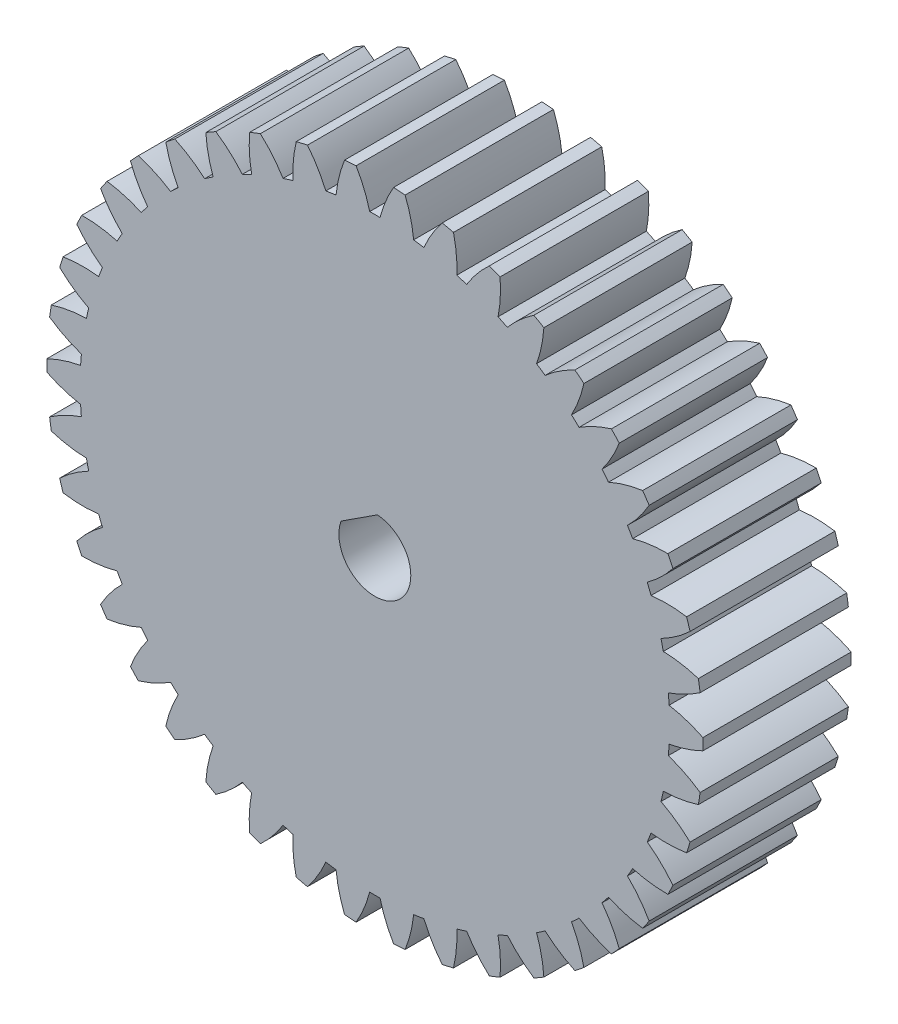
from build123d import *

# Parameters (mm, degrees)
BOSS_EXTRUDE1_DEPTH = 10


with BuildPart() as part:
    # Model → Boss-Extrude1 (new body)
    with BuildSketch(Plane.XY):
        with BuildLine():
            ThreePointArc((-22.121579276, -0.389044164), (-21.007963184, -0.843644989), (-19.841449955, -1.136987106))
            ThreePointArc((-19.841449955, -1.136987106), (-19.818428265, -1.48518588), (-19.789296488, -1.832926766))
            ThreePointArc((-19.789296488, -1.832926766), (-20.899060353, -2.296852269), (-21.932483536, -2.912351445))
            ThreePointArc((-21.932483536, -2.912351445), (-21.877882031, -3.297560139), (-21.816515489, -3.681749169))
            ThreePointArc((-21.816515489, -3.681749169), (-20.647582831, -3.965296612), (-19.450378218, -4.081502565))
            ThreePointArc((-19.450378218, -4.081502565), (-19.375717327, -4.422381042), (-19.295082838, -4.761896083))
            ThreePointArc((-19.295082838, -4.761896083), (-20.323307049, -5.386041643), (-21.253452357, -6.148689934))
            ThreePointArc((-21.253452357, -6.148689934), (-21.142048328, -6.521458234), (-21.024106796, -6.892209981))
            ThreePointArc((-21.024106796, -6.892209981), (-19.825969598, -6.998370062), (-18.624817172, -6.934844001))
            ThreePointArc((-18.624817172, -6.934844001), (-18.500184881, -7.260787518), (-18.369848921, -7.58449251))
            ThreePointArc((-18.369848921, -7.58449251), (-19.293564649, -8.354915747), (-20.099654173, -9.247676851))
            ThreePointArc((-20.099654173, -9.247676851), (-19.933936203, -9.599677728), (-19.7620543, -9.948710212))
            ThreePointArc((-19.7620543, -9.948710212), (-18.561476964, -9.875111488), (-17.383208487, -9.633272482))
            ThreePointArc((-17.383208487, -9.633272482), (-17.211388875, -9.937), (-17.034262934, -10.237663908))
            ThreePointArc((-17.034262934, -10.237663908), (-17.832835896, -11.137154839), (-18.496862928, -12.140085949))
            ThreePointArc((-18.496862928, -12.140085949), (-18.280532882, -12.463456285), (-18.058550166, -12.782972695))
            ThreePointArc((-18.058550166, -12.782972695), (-16.882351608, -12.531259242), (-15.753287649, -12.116509574))
            ThreePointArc((-15.753287649, -12.116509574), (-15.538118883, -12.391236322), (-15.318159662, -12.662142811))
            ThreePointArc((-15.318159662, -12.662142811), (-15.973751057, -13.670608295), (-16.48088233, -14.761305587))
            ThreePointArc((-16.48088233, -14.761305587), (-16.218772664, -15.048821823), (-15.951647862, -15.331684692))
            ThreePointArc((-15.951647862, -15.331684692), (-14.826102413, -14.907479372), (-13.771464397, -14.329083864))
            ThreePointArc((-13.771464397, -14.329083864), (-13.517752991, -14.568672901), (-13.259874016, -14.803770367))
            ThreePointArc((-13.259874016, -14.803770367), (-13.757839015, -15.898682952), (-14.096746055, -17.052782051))
            ThreePointArc((-14.096746055, -17.052782051), (-13.794711866, -17.29802155), (-13.488412104, -17.537912188))
            ThreePointArc((-13.488412104, -17.537912188), (-12.438662591, -16.950691047), (-11.482009387, -16.221570098))
            ThreePointArc((-11.482009387, -16.221570098), (-11.195422834, -16.420669401), (-10.905384695, -16.614706156))
            ThreePointArc((-10.905384695, -16.614706156), (-11.234599584, -17.771607304), (-11.397711767, -18.963327542))
            ThreePointArc((-11.397711767, -18.963327542), (-11.0625, -19.160812059), (-10.723867509, -19.352371706))
            ThreePointArc((-10.723867509, -19.352371706), (-9.7733636, -18.615252293), (-8.93606526, -17.751693262))
            ThreePointArc((-8.93606526, -17.751693262), (-8.623005431, -17.905855281), (-8.307287101, -18.054496864))
            ThreePointArc((-8.307287101, -18.054496864), (-8.460397763, -19.247543316), (-8.444071433, -20.450263633))
            ThreePointArc((-8.444071433, -20.450263633), (-8.083170164, -20.595581689), (-7.719769434, -20.73453122))
            ThreePointArc((-7.719769434, -20.73453122), (-6.889743816, -19.863979565), (-6.190504202, -18.885272933))
            ThreePointArc((-6.190504202, -18.885272933), (-5.857964337, -18.991053942), (-5.523618441, -19.090979947))
            ThreePointArc((-5.523618441, -19.090979947), (-5.497204636, -20.293521015), (-5.301804496, -21.480374627))
            ThreePointArc((-5.301804496, -21.480374627), (-4.923275664, -21.570280057), (-4.543224467, -21.653515568))
            ThreePointArc((-4.543224467, -21.653515568), (-3.852218541, -20.668978357), (-3.30665751, -19.596986812))
            ThreePointArc((-3.30665751, -19.596986812), (-2.962065998, -19.652023841), (-2.616561272, -19.701002084))
            ThreePointArc((-2.616561272, -19.701002084), (-2.411213042, -20.886174989), (-2.041104008, -22.030649546))
            ThreePointArc((-2.041104008, -22.030649546), (-1.653403321, -22.063134013), (-1.265191372, -22.08879616))
            ThreePointArc((-1.265191372, -22.08879616), (-0.728641069, -21.012266327), (-0.348945553, -19.87093639))
            ThreePointArc((-0.348945553, -19.87093639), (0, -19.874), (0.348945552, -19.87093639))
            ThreePointArc((0.348945552, -19.87093639), (0.728641068, -21.012266327), (1.265191371, -22.08879616))
            ThreePointArc((1.265191371, -22.08879616), (1.65340332, -22.063134013), (2.041104007, -22.030649547))
            ThreePointArc((2.041104007, -22.030649547), (2.411213041, -20.886174989), (2.616561271, -19.701002084))
            ThreePointArc((2.616561271, -19.701002084), (2.962065998, -19.652023841), (3.306657509, -19.596986812))
            ThreePointArc((3.306657509, -19.596986812), (3.85221854, -20.668978357), (4.543224466, -21.653515568))
            ThreePointArc((4.543224466, -21.653515568), (4.923275663, -21.570280057), (5.301804495, -21.480374627))
            ThreePointArc((5.301804495, -21.480374627), (5.497204636, -20.293521015), (5.52361844, -19.090979947))
            ThreePointArc((5.52361844, -19.090979947), (5.857964336, -18.991053942), (6.190504202, -18.885272932))
            ThreePointArc((6.190504202, -18.885272932), (6.889743816, -19.863979565), (7.719769433, -20.73453122))
            ThreePointArc((7.719769433, -20.73453122), (8.083170164, -20.595581689), (8.444071432, -20.450263633))
            ThreePointArc((8.444071432, -20.450263633), (8.460397762, -19.247543316), (8.307287101, -18.054496864))
            ThreePointArc((8.307287101, -18.054496864), (8.623005431, -17.905855281), (8.93606526, -17.751693262))
            ThreePointArc((8.93606526, -17.751693262), (9.773363599, -18.615252293), (10.723867508, -19.352371707))
            ThreePointArc((10.723867508, -19.352371707), (11.0625, -19.160812059), (11.397711767, -18.963327542))
            ThreePointArc((11.397711767, -18.963327542), (11.234599584, -17.771607304), (10.905384695, -16.614706156))
            ThreePointArc((10.905384695, -16.614706156), (11.195422834, -16.420669401), (11.482009386, -16.221570098))
            ThreePointArc((11.482009386, -16.221570098), (12.43866259, -16.950691047), (13.488412103, -17.537912188))
            ThreePointArc((13.488412103, -17.537912188), (13.794711866, -17.29802155), (14.096746055, -17.052782051))
            ThreePointArc((14.096746055, -17.052782051), (13.757839015, -15.898682953), (13.259874015, -14.803770367))
            ThreePointArc((13.259874015, -14.803770367), (13.51775299, -14.568672901), (13.771464396, -14.329083864))
            ThreePointArc((13.771464396, -14.329083864), (14.826102413, -14.907479372), (15.951647861, -15.331684693))
            ThreePointArc((15.951647861, -15.331684693), (16.218772664, -15.048821823), (16.48088233, -14.761305587))
            ThreePointArc((16.48088233, -14.761305587), (15.973751057, -13.670608295), (15.318159662, -12.662142811))
            ThreePointArc((15.318159662, -12.662142811), (15.538118882, -12.391236322), (15.753287649, -12.116509574))
            ThreePointArc((15.753287649, -12.116509574), (16.882351607, -12.531259242), (18.058550165, -12.782972695))
            ThreePointArc((18.058550165, -12.782972695), (18.280532881, -12.463456285), (18.496862927, -12.140085949))
            ThreePointArc((18.496862927, -12.140085949), (17.832835896, -11.137154839), (17.034262934, -10.237663908))
            ThreePointArc((17.034262934, -10.237663908), (17.211388874, -9.937), (17.383208486, -9.633272482))
            ThreePointArc((17.383208486, -9.633272482), (18.561476964, -9.875111488), (19.762054299, -9.948710212))
            ThreePointArc((19.762054299, -9.948710212), (19.933936202, -9.599677728), (20.099654172, -9.247676851))
            ThreePointArc((20.099654172, -9.247676851), (19.293564648, -8.354915747), (18.36984892, -7.58449251))
            ThreePointArc((18.36984892, -7.58449251), (18.50018488, -7.260787518), (18.624817171, -6.934844001))
            ThreePointArc((18.624817171, -6.934844001), (19.825969597, -6.998370062), (21.024106796, -6.892209981))
            ThreePointArc((21.024106796, -6.892209981), (21.142048328, -6.521458234), (21.253452357, -6.148689934))
            ThreePointArc((21.253452357, -6.148689934), (20.323307049, -5.386041643), (19.295082837, -4.761896083))
            ThreePointArc((19.295082837, -4.761896083), (19.375717326, -4.422381042), (19.450378217, -4.081502565))
            ThreePointArc((19.450378217, -4.081502565), (20.647582831, -3.965296612), (21.816515488, -3.681749169))
            ThreePointArc((21.816515488, -3.681749169), (21.87788203, -3.297560139), (21.932483536, -2.912351445))
            ThreePointArc((21.932483536, -2.912351445), (20.899060353, -2.296852269), (19.789296487, -1.832926766))
            ThreePointArc((19.789296487, -1.832926766), (19.818428265, -1.48518588), (19.841449955, -1.136987106))
            ThreePointArc((19.841449955, -1.136987106), (21.007963183, -0.843644989), (22.121579275, -0.389044164))
            ThreePointArc((22.121579275, -0.389044164), (22.125, 0), (22.121579275, 0.389044164))
            ThreePointArc((22.121579275, 0.389044164), (21.007963183, 0.843644989), (19.841449955, 1.136987106))
            ThreePointArc((19.841449955, 1.136987106), (19.818428265, 1.48518588), (19.789296487, 1.832926766))
            ThreePointArc((19.789296487, 1.832926766), (20.899060353, 2.296852269), (21.932483536, 2.912351444))
            ThreePointArc((21.932483536, 2.912351444), (21.87788203, 3.297560139), (21.816515488, 3.681749169))
            ThreePointArc((21.816515488, 3.681749169), (20.647582831, 3.965296612), (19.450378217, 4.081502565))
            ThreePointArc((19.450378217, 4.081502565), (19.375717326, 4.422381041), (19.295082837, 4.761896083))
            ThreePointArc((19.295082837, 4.761896083), (20.323307049, 5.386041643), (21.253452357, 6.148689934))
            ThreePointArc((21.253452357, 6.148689934), (21.142048328, 6.521458234), (21.024106796, 6.892209981))
            ThreePointArc((21.024106796, 6.892209981), (19.825969597, 6.998370061), (18.624817171, 6.934844001))
            ThreePointArc((18.624817171, 6.934844001), (18.50018488, 7.260787518), (18.36984892, 7.58449251))
            ThreePointArc((18.36984892, 7.58449251), (19.293564648, 8.354915746), (20.099654172, 9.247676851))
            ThreePointArc((20.099654172, 9.247676851), (19.933936202, 9.599677728), (19.762054299, 9.948710211))
            ThreePointArc((19.762054299, 9.948710211), (18.561476964, 9.875111488), (17.383208486, 9.633272482))
            ThreePointArc((17.383208486, 9.633272482), (17.211388874, 9.937), (17.034262934, 10.237663908))
            ThreePointArc((17.034262934, 10.237663908), (17.832835895, 11.137154838), (18.496862927, 12.140085948))
            ThreePointArc((18.496862927, 12.140085948), (18.280532881, 12.463456284), (18.058550165, 12.782972695))
            ThreePointArc((18.058550165, 12.782972695), (16.882351607, 12.531259242), (15.753287649, 12.116509573))
            ThreePointArc((15.753287649, 12.116509573), (15.538118882, 12.391236322), (15.318159662, 12.662142811))
            ThreePointArc((15.318159662, 12.662142811), (15.973751057, 13.670608295), (16.48088233, 14.761305587))
            ThreePointArc((16.48088233, 14.761305587), (16.218772664, 15.048821823), (15.951647861, 15.331684692))
            ThreePointArc((15.951647861, 15.331684692), (14.826102413, 14.907479372), (13.771464396, 14.329083863))
            ThreePointArc((13.771464396, 14.329083863), (13.51775299, 14.568672901), (13.259874015, 14.803770367))
            ThreePointArc((13.259874015, 14.803770367), (13.757839015, 15.898682952), (14.096746055, 17.05278205))
            ThreePointArc((14.096746055, 17.05278205), (13.794711866, 17.298021549), (13.488412103, 17.537912188))
            ThreePointArc((13.488412103, 17.537912188), (12.43866259, 16.950691046), (11.482009386, 16.221570098))
            ThreePointArc((11.482009386, 16.221570098), (11.195422834, 16.420669401), (10.905384695, 16.614706156))
            ThreePointArc((10.905384695, 16.614706156), (11.234599584, 17.771607304), (11.397711767, 18.963327542))
            ThreePointArc((11.397711767, 18.963327542), (11.0625, 19.160812058), (10.723867508, 19.352371706))
            ThreePointArc((10.723867508, 19.352371706), (9.773363599, 18.615252293), (8.93606526, 17.751693262))
            ThreePointArc((8.93606526, 17.751693262), (8.623005431, 17.90585528), (8.307287101, 18.054496864))
            ThreePointArc((8.307287101, 18.054496864), (8.460397762, 19.247543315), (8.444071432, 20.450263632))
            ThreePointArc((8.444071432, 20.450263632), (8.083170164, 20.595581689), (7.719769433, 20.734531219))
            ThreePointArc((7.719769433, 20.734531219), (6.889743816, 19.863979564), (6.190504202, 18.885272932))
            ThreePointArc((6.190504202, 18.885272932), (5.857964336, 18.991053942), (5.52361844, 19.090979946))
            ThreePointArc((5.52361844, 19.090979946), (5.497204636, 20.293521015), (5.301804495, 21.480374626))
            ThreePointArc((5.301804495, 21.480374626), (4.923275663, 21.570280057), (4.543224466, 21.653515568))
            ThreePointArc((4.543224466, 21.653515568), (3.85221854, 20.668978356), (3.306657509, 19.596986812))
            ThreePointArc((3.306657509, 19.596986812), (2.962065998, 19.65202384), (2.616561271, 19.701002084))
            ThreePointArc((2.616561271, 19.701002084), (2.411213041, 20.886174989), (2.041104007, 22.030649546))
            ThreePointArc((2.041104007, 22.030649546), (1.65340332, 22.063134012), (1.265191371, 22.08879616))
            ThreePointArc((1.265191371, 22.08879616), (0.728641068, 21.012266326), (0.348945552, 19.870936389))
            ThreePointArc((0.348945552, 19.870936389), (0, 19.874), (-0.348945553, 19.870936389))
            ThreePointArc((-0.348945553, 19.870936389), (-0.728641069, 21.012266326), (-1.265191372, 22.08879616))
            ThreePointArc((-1.265191372, 22.08879616), (-1.653403321, 22.063134012), (-2.041104008, 22.030649546))
            ThreePointArc((-2.041104008, 22.030649546), (-2.411213042, 20.886174989), (-2.616561272, 19.701002084))
            ThreePointArc((-2.616561272, 19.701002084), (-2.962065998, 19.65202384), (-3.30665751, 19.596986812))
            ThreePointArc((-3.30665751, 19.596986812), (-3.852218541, 20.668978356), (-4.543224467, 21.653515568))
            ThreePointArc((-4.543224467, 21.653515568), (-4.923275664, 21.570280057), (-5.301804496, 21.480374626))
            ThreePointArc((-5.301804496, 21.480374626), (-5.497204636, 20.293521015), (-5.523618441, 19.090979946))
            ThreePointArc((-5.523618441, 19.090979946), (-5.857964337, 18.991053942), (-6.190504202, 18.885272932))
            ThreePointArc((-6.190504202, 18.885272932), (-6.889743816, 19.863979564), (-7.719769434, 20.734531219))
            ThreePointArc((-7.719769434, 20.734531219), (-8.083170164, 20.595581689), (-8.444071433, 20.450263632))
            ThreePointArc((-8.444071433, 20.450263632), (-8.460397763, 19.247543315), (-8.307287102, 18.054496864))
            ThreePointArc((-8.307287102, 18.054496864), (-8.623005432, 17.905855281), (-8.93606526, 17.751693262))
            ThreePointArc((-8.93606526, 17.751693262), (-9.7733636, 18.615252293), (-10.723867509, 19.352371706))
            ThreePointArc((-10.723867509, 19.352371706), (-11.0625, 19.160812059), (-11.397711768, 18.963327542))
            ThreePointArc((-11.397711768, 18.963327542), (-11.234599584, 17.771607304), (-10.905384696, 16.614706156))
            ThreePointArc((-10.905384696, 16.614706156), (-11.195422834, 16.420669401), (-11.482009387, 16.221570098))
            ThreePointArc((-11.482009387, 16.221570098), (-12.438662591, 16.950691046), (-13.488412104, 17.537912188))
            ThreePointArc((-13.488412104, 17.537912188), (-13.794711867, 17.298021549), (-14.096746055, 17.05278205))
            ThreePointArc((-14.096746055, 17.05278205), (-13.757839016, 15.898682952), (-13.259874016, 14.803770367))
            ThreePointArc((-13.259874016, 14.803770367), (-13.517752991, 14.568672901), (-13.771464397, 14.329083864))
            ThreePointArc((-13.771464397, 14.329083864), (-14.826102414, 14.907479372), (-15.951647862, 15.331684692))
            ThreePointArc((-15.951647862, 15.331684692), (-16.218772665, 15.048821823), (-16.48088233, 14.761305587))
            ThreePointArc((-16.48088233, 14.761305587), (-15.973751057, 13.670608295), (-15.318159663, 12.662142811))
            ThreePointArc((-15.318159663, 12.662142811), (-15.538118883, 12.391236322), (-15.753287649, 12.116509574))
            ThreePointArc((-15.753287649, 12.116509574), (-16.882351608, 12.531259242), (-18.058550166, 12.782972695))
            ThreePointArc((-18.058550166, 12.782972695), (-18.280532882, 12.463456284), (-18.496862928, 12.140085948))
            ThreePointArc((-18.496862928, 12.140085948), (-17.832835896, 11.137154839), (-17.034262935, 10.237663908))
            ThreePointArc((-17.034262935, 10.237663908), (-17.211388875, 9.937), (-17.383208487, 9.633272482))
            ThreePointArc((-17.383208487, 9.633272482), (-18.561476965, 9.875111488), (-19.7620543, 9.948710211))
            ThreePointArc((-19.7620543, 9.948710211), (-19.933936203, 9.599677728), (-20.099654173, 9.247676851))
            ThreePointArc((-20.099654173, 9.247676851), (-19.293564649, 8.354915746), (-18.369848921, 7.58449251))
            ThreePointArc((-18.369848921, 7.58449251), (-18.500184881, 7.260787518), (-18.624817172, 6.934844001))
            ThreePointArc((-18.624817172, 6.934844001), (-19.825969598, 6.998370061), (-21.024106797, 6.892209981))
            ThreePointArc((-21.024106797, 6.892209981), (-21.142048328, 6.521458234), (-21.253452357, 6.148689934))
            ThreePointArc((-21.253452357, 6.148689934), (-20.323307049, 5.386041643), (-19.295082838, 4.761896083))
            ThreePointArc((-19.295082838, 4.761896083), (-19.375717327, 4.422381041), (-19.450378218, 4.081502565))
            ThreePointArc((-19.450378218, 4.081502565), (-20.647582831, 3.965296612), (-21.816515489, 3.681749169))
            ThreePointArc((-21.816515489, 3.681749169), (-21.877882031, 3.297560139), (-21.932483537, 2.912351444))
            ThreePointArc((-21.932483537, 2.912351444), (-20.899060353, 2.296852269), (-19.789296488, 1.832926766))
            ThreePointArc((-19.789296488, 1.832926766), (-19.818428266, 1.48518588), (-19.841449955, 1.136987106))
            ThreePointArc((-19.841449955, 1.136987106), (-21.007963184, 0.843644989), (-22.121579276, 0.389044164))
            ThreePointArc((-22.121579276, 0.389044164), (-22.125, 0), (-22.121579276, -0.389044164))
        make_face()
        with BuildLine():
            Line((0.171327862, 2.418940215), (-2.277476436, 0.832902205))
            ThreePointArc((-2.277476436, 0.832902205), (1.318273338, -2.035382126), (0.171327862, 2.418940215))
        make_face(mode=Mode.SUBTRACT)
    extrude(amount=BOSS_EXTRUDE1_DEPTH)


solid = part.part
